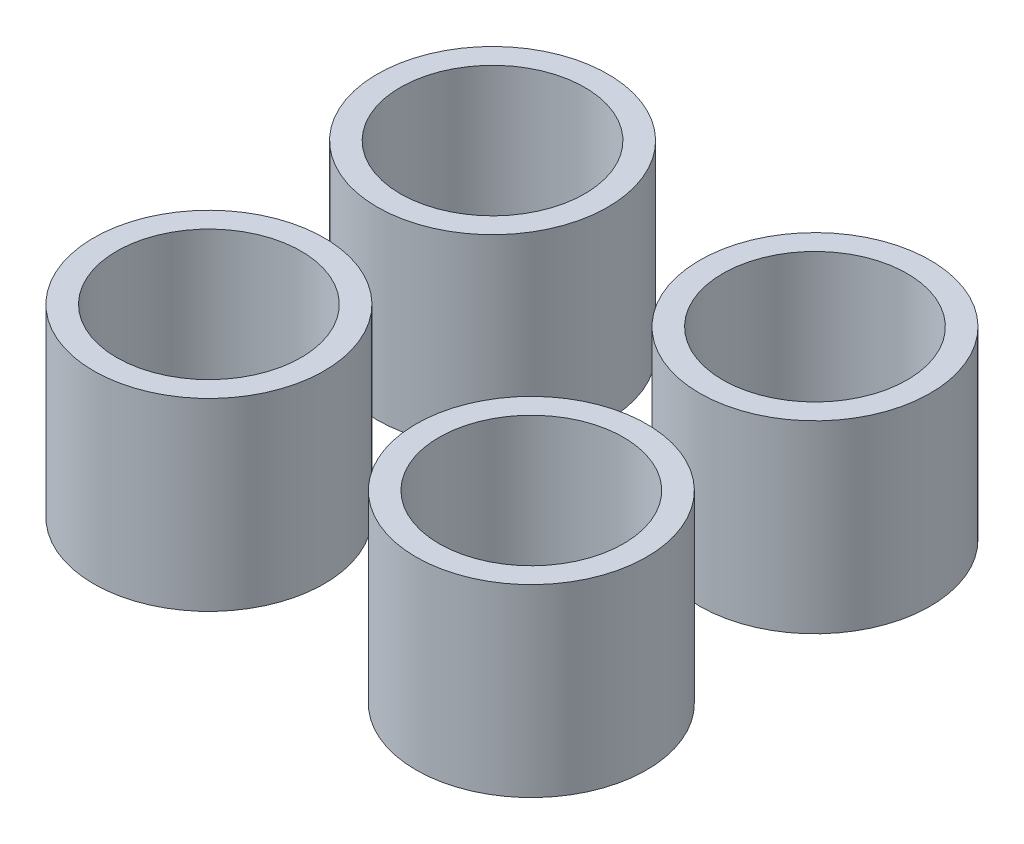
from build123d import *

# Parameters (mm, degrees)
SKETCH1_R             = 2.5
BOSS_EXTRUDE1_DEPTH   = 4
BOSS_EXTRUDE1_2_DEPTH = 4
BOSS_EXTRUDE1_3_DEPTH = 4
BOSS_EXTRUDE1_4_DEPTH = 4
SKETCH2_R             = 2
CUT_EXTRUDE1_DEPTH    = 5


with BuildPart() as part:
    # Sketch1 → Boss-Extrude1 (new body)
    with BuildSketch(Plane(origin=(0, 0, 0), x_dir=(1, 0, 0), z_dir=(0, 1, 0))):
        with Locations(Location((0, 0, 0), (0, 0, 270))):
            Circle(SKETCH1_R)
    extrude(amount=BOSS_EXTRUDE1_DEPTH)


with BuildPart() as body_2:
    # Sketch1 → Boss-Extrude1 2 (new body)
    with BuildSketch(Plane(origin=(0, 0, 0), x_dir=(1, 0, 0), z_dir=(0, 1, 0))):
        with Locations(Location((-6.992070587, 0, 0), (0, 0, 270))):
            Circle(SKETCH1_R)
    extrude(amount=BOSS_EXTRUDE1_2_DEPTH)


with BuildPart() as body_3:
    # Sketch1 → Boss-Extrude1 3 (new body)
    with BuildSketch(Plane(origin=(0, 0, 0), x_dir=(1, 0, 0), z_dir=(0, 1, 0))):
        with Locations(Location((-6.992070587, -6.151493795, 0), (0, 0, 270))):
            Circle(SKETCH1_R)
    extrude(amount=BOSS_EXTRUDE1_3_DEPTH)


with BuildPart() as body_4:
    # Sketch1 → Boss-Extrude1 4 (new body)
    with BuildSketch(Plane(origin=(0, 0, 0), x_dir=(1, 0, 0), z_dir=(0, 1, 0))):
        with Locations(Location((0, -6.151493795, 0), (0, 0, 270))):
            Circle(SKETCH1_R)
    extrude(amount=BOSS_EXTRUDE1_4_DEPTH)


with BuildPart() as cut_extrude1_tool:
    # Sketch2 → Cut-Extrude1 (new body)
    with BuildSketch(Plane(origin=(0, 4, 0), x_dir=(1, 0, 0), z_dir=(0, 1, 0))):
        with Locations(Location((-6.992070587, 0, 0), (0, 0, 270))):
            Circle(SKETCH2_R)
        with Locations(Location((0, 0, 0), (0, 0, 270))):
            Circle(SKETCH2_R)
        with Locations(Location((-6.992070587, -6.151493795, 0), (0, 0, 270))):
            Circle(SKETCH2_R)
        with Locations(Location((0, -6.151493795, 0), (0, 0, 270))):
            Circle(SKETCH2_R)
    extrude(amount=-CUT_EXTRUDE1_DEPTH)


with BuildPart() as part_1:
    add(part.part)

    # Cut-Extrude1: cut by cut_extrude1_tool
    add(cut_extrude1_tool.part, mode=Mode.SUBTRACT)


with BuildPart() as body_2_1:
    add(body_2.part)

    # Cut-Extrude1: cut by cut_extrude1_tool
    add(cut_extrude1_tool.part, mode=Mode.SUBTRACT)


with BuildPart() as body_3_1:
    add(body_3.part)

    # Cut-Extrude1: cut by cut_extrude1_tool
    add(cut_extrude1_tool.part, mode=Mode.SUBTRACT)


with BuildPart() as body_4_1:
    add(body_4.part)

    # Cut-Extrude1: cut by cut_extrude1_tool
    add(cut_extrude1_tool.part, mode=Mode.SUBTRACT)


solid = Compound([part_1.part, body_2_1.part, body_3_1.part, body_4_1.part])
